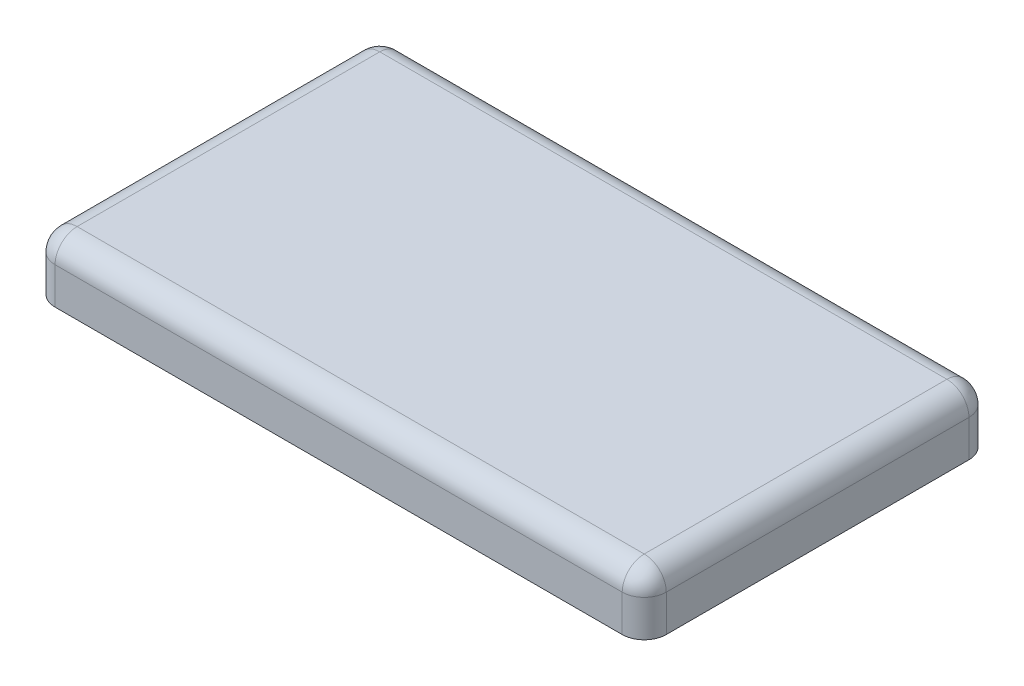
from build123d import *

# Parameters (mm, degrees)
SKETCH1_W           = 41.6
SKETCH1_H           = 23.6
BOSS_EXTRUDE1_DEPTH = 4
SKETCH2_W           = 38.5
SKETCH2_H           = 20.5
CUT_EXTRUDE1_DEPTH  = 2.6
FILLET1_R           = 1.5


with BuildPart() as part:
    # Sketch1 → Boss-Extrude1 (new body)
    with BuildSketch(Plane(origin=(0, 0, 0), x_dir=(1, 0, 0), z_dir=(0, 1, 0))):
        with Locations((20.8, 11.8)):
            Rectangle(SKETCH1_W, SKETCH1_H)
    extrude(amount=BOSS_EXTRUDE1_DEPTH)

    # Sketch2 → Cut-Extrude1 (cut)
    with BuildSketch(Plane.XZ):
        with Locations((20.8, -11.8)):
            Rectangle(SKETCH2_W, SKETCH2_H)
    extrude(amount=-CUT_EXTRUDE1_DEPTH, mode=Mode.SUBTRACT)

    # Fillet1
    fillet1_edges = [part.edges().sort_by_distance(p)[0] for p in [
        (41.6, 4, -11.8),
        (20.8, 4, -23.6),
        (0, 4, -11.8),
        (20.8, 4, 0),
        (0, 2, -23.6),
        (41.6, 2, -23.6),
        (41.6, 2, 0),
        (0, 2, 0),
    ]]
    fillet(fillet1_edges, radius=FILLET1_R)


solid = part.part
